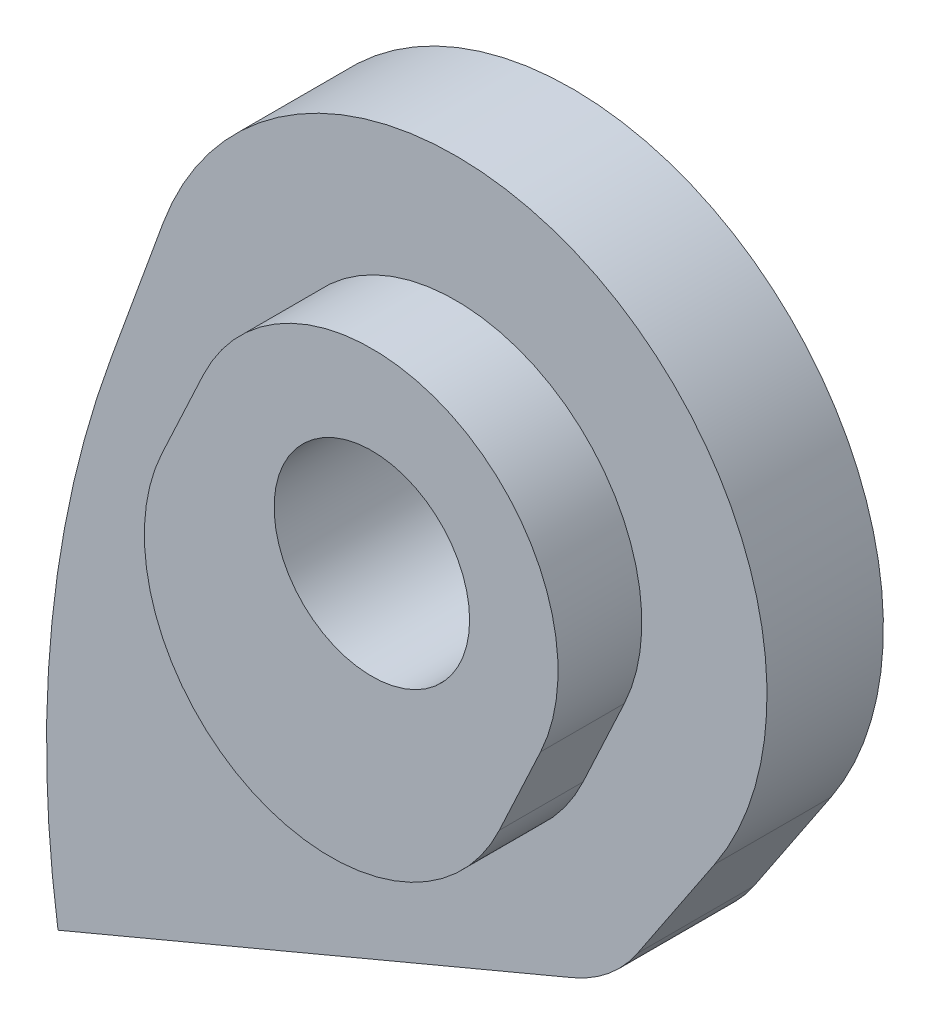
from build123d import *
from build123d.topology import SkipClean

# Parameters (mm, degrees)
SKETCH3_R           = 2.75
SKETCH3_R_2         = 2.1
BOSS_EXTRUDE2_DEPTH = 11
BOSS_EXTRUDE4_START = 2.5
BOSS_EXTRUDE4_DEPTH = 2.5
BOSS_EXTRUDE3_START = 3
BOSS_EXTRUDE3_DEPTH = 3
SKETCH14_W          = 47.285712055
SKETCH14_H          = 12.595473758
CUT_EXTRUDE1_DEPTH  = 92.326119258
BOSS_EXTRUDE5_DEPTH = 1.8
SKETCH15_R          = 2.1
CUT_EXTRUDE2_DEPTH  = 88.559639697


with BuildPart() as part:
    # Sketch3 → Boss-Extrude2 (new body)
    with BuildSketch(Plane.XY):
        with BuildLine():
            Line((11.81639044, 60.252883085), (11.728372068, 60.311638564))
            ThreePointArc((11.728372068, 60.311638564), (8.917204522, 62.7925154), (6.866230988, 65.931132995))
            ThreePointArc((6.866230988, 65.931132995), (6.025591445, 67.274340702), (4.901176311, 68.390840765))
            ThreePointArc((4.901176311, 68.390840765), (3.375934297, 70.989881123), (4.020351516, 73.93370524))
            Line((4.020351516, 73.93370524), (5.678869184, 76.41823992))
            ThreePointArc((5.678869184, 76.41823992), (3.137547336, 86.100651278), (-6.171856019, 82.420649156))
            Line((-6.171856019, 82.420649156), (-7.290261888, 79.347854286))
            ThreePointArc((-7.290261888, 79.347854286), (-8.557893098, 69.185727028), (-5.279809822, 59.483671095))
            ThreePointArc((-5.279809822, 59.483671095), (-2.848156457, 57.139360441), (0.414833066, 56.266646336))
            ThreePointArc((0.414833066, 56.266646336), (3.287818882, 55.822166382), (5.91364728, 54.574514525))
            Line((5.91364728, 54.574514525), (7.374782695, 53.599153256))
            ThreePointArc((7.374782695, 53.599153256), (10.815902262, 50.678650143), (13.499590609, 47.049812979))
            ThreePointArc((13.499590609, 47.049812979), (24.965953819, 46.665736496), (20.21385057, 57.108078892))
            ThreePointArc((20.21385057, 57.108078892), (15.833272198, 58.194897845), (11.81639044, 60.252883085))
        make_face()
        with Locations((19.351869275, 50.413343031)):
            Circle(SKETCH3_R, mode=Mode.SUBTRACT)
        with Locations((0.471910886, 63.016405008)):
            Circle(SKETCH3_R, mode=Mode.SUBTRACT)
        with Locations((0.114687614, 80.132534397)):
            Circle(SKETCH3_R_2, mode=Mode.SUBTRACT)
    extrude(amount=BOSS_EXTRUDE2_DEPTH)

    # Sketch13 → Boss-Extrude4 (add)
    with SkipClean():  # the faces are left unmerged after this step: merging them gives an invalid solid
        with BuildSketch(Plane(origin=(0, 0, 0), x_dir=(-1, 0, 0), z_dir=(0, 0, -1)).offset(BOSS_EXTRUDE4_START)):
            with BuildLine():
                Line((-5.678869184, 76.41823992), (-4.020351516, 73.93370524))
                ThreePointArc((-4.020351516, 73.93370524), (-3.407782277, 73.255690271), (-2.625844204, 72.782913134))
                Line((-2.625844204, 72.782913134), (8.427696777, 68.139691908))
                ThreePointArc((8.427696777, 68.139691908), (8.557268078, 73.814637343), (7.290261888, 79.347854286))
                Line((7.290261888, 79.347854286), (6.171856019, 82.420649156))
                ThreePointArc((6.171856019, 82.420649156), (-3.137547336, 86.100651278), (-5.678869184, 76.41823992))
            make_face()
        extrude(amount=-BOSS_EXTRUDE4_DEPTH)

    # Sketch12 → Boss-Extrude3 (add)
    with SkipClean():  # the faces are left unmerged after this step: merging them gives an invalid solid
        with BuildSketch(Plane(origin=(0, 0, -2.5), x_dir=(-1, 0, 0), z_dir=(0, 0, -1)).offset(BOSS_EXTRUDE3_START)):
            with BuildLine():
                Line((8.013597957, 76.965805827), (4.924247842, 69.611373108))
                Line((4.924247842, 69.611373108), (8.427696777, 68.139691908))
                ThreePointArc((8.427696777, 68.139691908), (8.649339764, 72.572862025), (8.013597957, 76.965805827))
            make_face()
        extrude(amount=-BOSS_EXTRUDE3_DEPTH)

    # Sketch14 → Cut-Extrude1 (cut, through all)
    with BuildSketch(Plane(origin=(0, 0, 0), x_dir=(1, 0, 0), z_dir=(0, 1, 0))):
        with Locations((8.412006537, -6.297736879)):
            Rectangle(SKETCH14_W, SKETCH14_H)
    extrude(amount=CUT_EXTRUDE1_DEPTH, mode=Mode.SUBTRACT)

    # Sketch16 → Boss-Extrude5 (add)
    with BuildSketch(Plane.XY):
        with BuildLine():
            Line((3.739918762, 78.44206135), (2.852420412, 76.538814997))
            ThreePointArc((2.852420412, 76.538814997), (-2.463283783, 74.604056896), (-4.398041884, 79.919761091))
            Line((-4.398041884, 79.919761091), (-3.510543534, 81.823007444))
            ThreePointArc((-3.510543534, 81.823007444), (1.805160661, 83.757765545), (3.739918762, 78.44206135))
        make_face()
    extrude(amount=BOSS_EXTRUDE5_DEPTH)

    # Sketch15 → Cut-Extrude2 (cut, through all)
    with BuildSketch(Plane.XY.offset(1.8)):
        with Locations((0.114687614, 80.132534397)):
            Circle(SKETCH15_R)
    extrude(amount=-CUT_EXTRUDE2_DEPTH, mode=Mode.SUBTRACT)


solid = part.part
